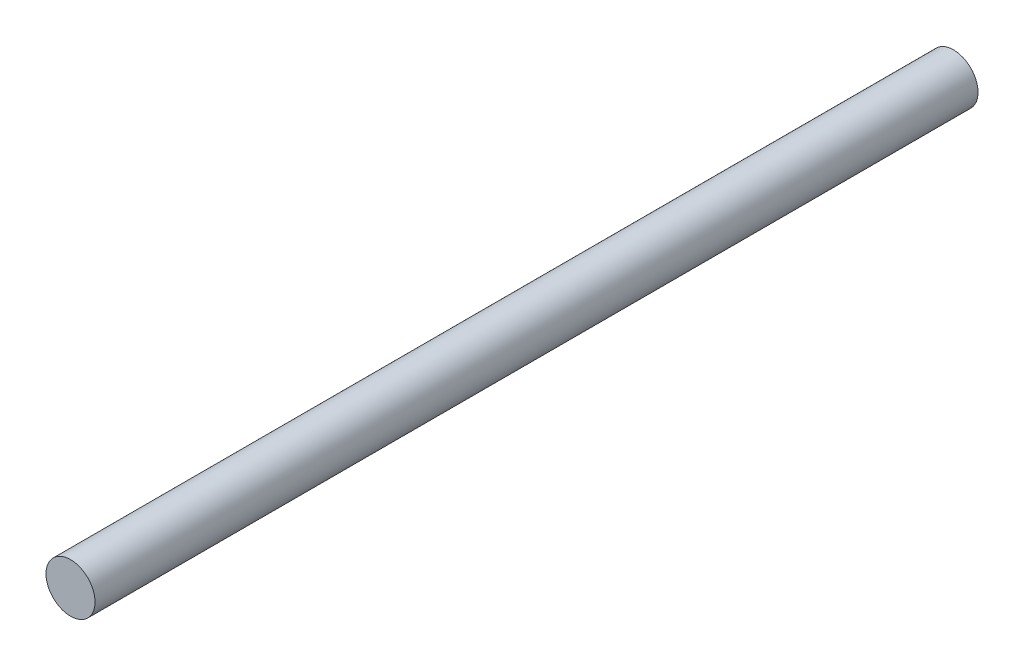
from build123d import *

# Parameters (mm, degrees)
CROQUIS1_R              = 2.5
SALIENTE_EXTRUIR1_DEPTH = 90


with BuildPart() as part:
    # Croquis1 → Saliente-Extruir1 (new body)
    with BuildSketch(Plane.XY):
        with Locations(Location((0, 0, 0), (0, 0, 180))):
            Circle(CROQUIS1_R)
    extrude(amount=SALIENTE_EXTRUIR1_DEPTH)


solid = part.part
